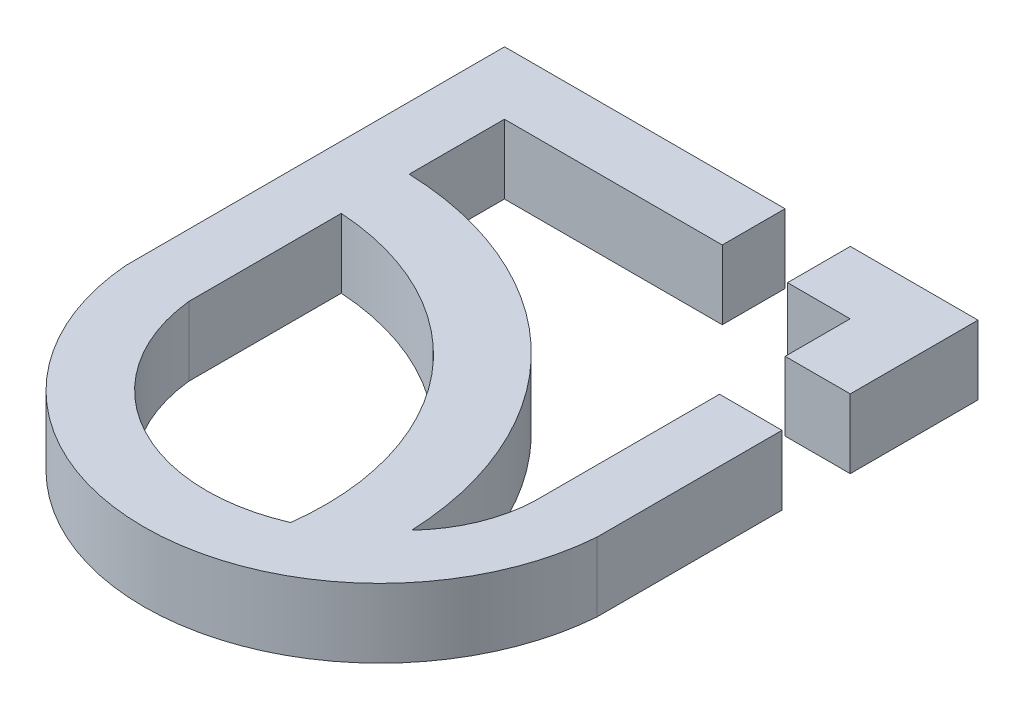
from build123d import *

# Parameters (mm, degrees)
BOSS_EXTRUDE1_DEPTH   = 25.4
BOSS_EXTRUDE1_2_DEPTH = 25.4


with BuildPart() as part:
    # Sketch1 → Boss-Extrude1 (new body)
    with BuildSketch(Plane(origin=(0, 0, 0), x_dir=(1, 0, 0), z_dir=(0, 1, 0))):
        with BuildLine():
            Line((0, 80.02759766), (0, 219.067642019))
            Line((0, 219.067642019), (103.040086398, 219.067642019))
            Line((103.040086398, 219.067642019), (103.040086398, 195.999460881))
            Line((103.040086398, 195.999460881), (23.011829096, 195.999460881))
            Line((23.011829096, 195.999460881), (23.011829096, 161.013213822))
            ThreePointArc((23.011829096, 161.013213822), (101.985495584, 126.901824422), (136.744902109, 48.211224327))
            ThreePointArc((136.744902109, 48.211224327), (146.280346481, 62.911008862), (150.026111113, 80.02759766))
            Line((150.026111113, 80.02759766), (150.026111113, 148.011746996))
            Line((150.026111113, 148.011746996), (172.974333949, 148.011746996))
            Line((172.974333949, 148.011746996), (172.974333949, 80.02759766))
            ThreePointArc((172.974333949, 80.02759766), (86.487166974, 0.037389651), (0, 80.02759766))
        make_face()
        with BuildLine():
            Line((23.011829096, 136.058182002), (23.011829096, 80.02759766))
            ThreePointArc((23.011829096, 80.02759766), (54.48283159, 31.69310754), (112.066438029, 28.410547154))
            ThreePointArc((112.066438029, 28.410547154), (90.841729512, 101.512108787), (23.011829096, 136.058182002))
        make_face(mode=Mode.SUBTRACT)
    extrude(amount=BOSS_EXTRUDE1_DEPTH)


with BuildPart() as body_2:
    # Sketch1 → Boss-Extrude1 2 (new body)
    with BuildSketch(Plane(origin=(0, 0, 0), x_dir=(1, 0, 0), z_dir=(0, 1, 0))):
        Polygon((173.927929859, 172.130085515), (150.026111113, 172.130085515), (150.026111113, 195.999460881), (127.017693125, 195.999460881), (127.017693125, 219.067642019), (173.927929859, 219.067642019), align=None)
    extrude(amount=BOSS_EXTRUDE1_2_DEPTH)


solid = Compound([part.part, body_2.part])
